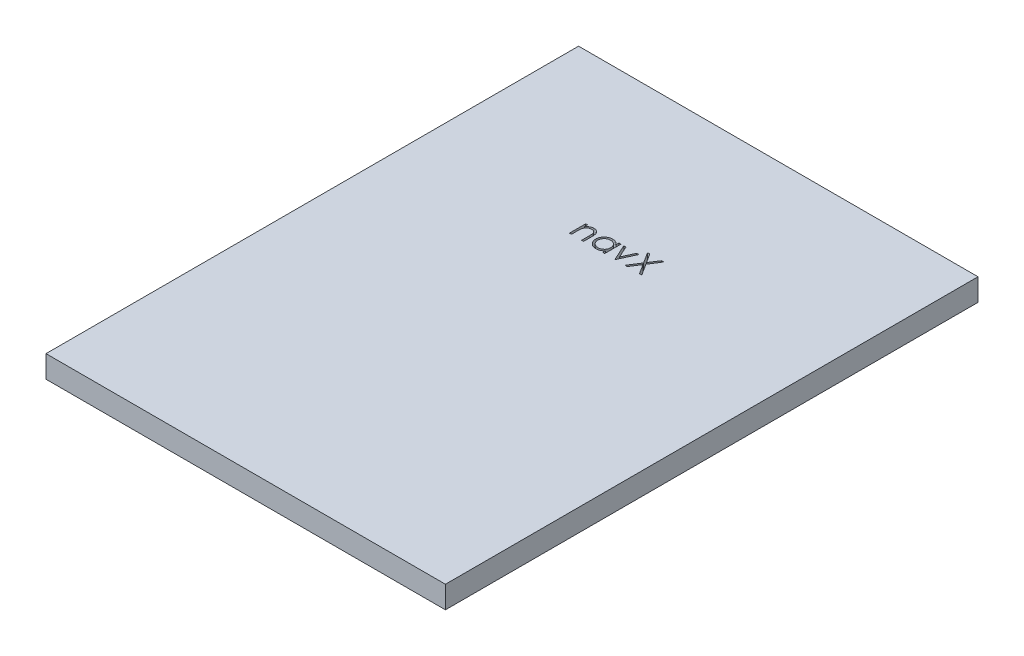
from build123d import *

# Parameters (mm, degrees)
SKETCH1_W           = 57.15
SKETCH1_H           = 76.2
BOSS_EXTRUDE1_DEPTH = 3.175
CUT_EXTRUDE1_DEPTH  = 1.27


with BuildPart() as part:
    # Sketch1 → Boss-Extrude1 (new body)
    with BuildSketch(Plane(origin=(0, 0, 0), x_dir=(1, 0, 0), z_dir=(0, 1, 0))):
        Rectangle(SKETCH1_W, SKETCH1_H)
    extrude(amount=BOSS_EXTRUDE1_DEPTH)

    # Sketch2 → Cut-Extrude1 (cut)
    # profile 1 of 4: a face of its own
    with BuildSketch(Plane(origin=(0, 3.175, 0), x_dir=(-1, 0, 0), z_dir=(0, 1, 0))):
        with BuildLine():
            Line((6.055318585, -16.590002596), (5.770382688, -16.590002596))
            Line((5.770382688, -16.590002596), (5.770382688, -16.171502996))
            add(Edge.make_bspline(
                [(5.770382688, -16.171502996), (5.740011779, -16.209517079), (5.68116854, -16.283168869), (5.58216602, -16.379210072), (5.478935847, -16.459804005), (5.3698014, -16.523260139), (5.255885696, -16.571252171), (5.137511969, -16.605860082), (5.01403952, -16.626623661), (4.930069938, -16.629335713), (4.88759022, -16.630707724)],
                knots=[0, 0, 0, 0, 1.127869841, 2.185233117, 3.191641716, 4.159226741, 5.10472073, 6.052603964, 7.014823782, 8, 8, 8, 8], degree=3))
            add(Edge.make_bspline(
                [(4.88759022, -16.630707724), (4.844634079, -16.629214017), (4.760516404, -16.626289008), (4.638482352, -16.600515848), (4.523708355, -16.559729658), (4.417729129, -16.502406678), (4.322175382, -16.431236503), (4.239313996, -16.347753357), (4.169631782, -16.252962996), (4.123122139, -16.164236993), (4.093040195, -16.085425579), (4.073271524, -16.0180161), (4.057278247, -15.942883297), (4.04294765, -15.86021293), (4.033387568, -15.769672957), (4.025809426, -15.671479471), (4.020388991, -15.565649476), (4.020173366, -15.492455289), (4.020062175, -15.454711129)],
                knots=[0, 0, 0, 0, 1.235764162, 2.419900973, 3.574701258, 4.732869372, 5.875730734, 6.993815468, 8.107424371, 9.251605764, 9.866123335, 10.534503958, 11.272175692, 12.077112099, 12.949509943, 13.89253218, 14.913238789, 16, 16, 16, 16], degree=3))
            Line((4.020062175, -15.454711129), (4.020062175, -14.269810288))
            Line((4.020062175, -14.269810288), (4.304998072, -14.269810288))
            Line((4.304998072, -14.269810288), (4.304998072, -15.361216538))
            add(Edge.make_bspline(
                [(4.304998072, -15.361216538), (4.305172614, -15.392805516), (4.305506484, -15.453229854), (4.306573304, -15.539742593), (4.30908455, -15.617988608), (4.312758395, -15.688192769), (4.31790085, -15.750098127), (4.323405942, -15.804018032), (4.330082808, -15.849474875), (4.33603676, -15.876838879), (4.338707007, -15.889111169)],
                knots=[0, 0, 0, 0, 1.430803381, 2.736883362, 3.918614142, 4.976458302, 5.92063272, 6.731858525, 7.431260095, 8, 8, 8, 8], degree=3))
            add(Edge.make_bspline(
                [(4.338707007, -15.889111169), (4.348298036, -15.925160767), (4.366708706, -15.994360559), (4.413127221, -16.088064198), (4.470383963, -16.168488135), (4.541323753, -16.233978346), (4.624041324, -16.28496079), (4.718674187, -16.320307963), (4.824242938, -16.342422975), (4.898497037, -16.344624403), (4.937199595, -16.345771826)],
                knots=[0, 0, 0, 0, 1.084232, 2.08126119, 3.027460722, 3.945137793, 4.874029258, 5.839697328, 6.874011781, 8, 8, 8, 8], degree=3))
            add(Edge.make_bspline(
                [(4.937199595, -16.345771826), (4.960123112, -16.345346396), (5.005488159, -16.344504481), (5.072721891, -16.335837862), (5.13814421, -16.32215003), (5.201579846, -16.301932164), (5.263156997, -16.277350064), (5.323130484, -16.247186672), (5.380662305, -16.210701491), (5.436561438, -16.1696921), (5.488517318, -16.124022995), (5.537550393, -16.076530302), (5.580632017, -16.025225386), (5.619738091, -15.971922216), (5.653454407, -15.915550043), (5.682896587, -15.856711455), (5.707874702, -15.79531338), (5.720286952, -15.752700383), (5.726497471, -15.731378798)],
                knots=[0, 0, 0, 0, 1.023939463, 2.026349741, 3.024227553, 4.007104963, 4.997624259, 5.984875705, 7.002218968, 8.038748769, 9.079772093, 10.091408226, 11.086177727, 12.069739863, 13.043026652, 14.017557731, 15.008077027, 16, 16, 16, 16], degree=3))
            add(Edge.make_bspline(
                [(5.726497471, -15.731378798), (5.730071296, -15.715725863), (5.737851324, -15.681650245), (5.746254351, -15.62572995), (5.753881223, -15.561041615), (5.76026475, -15.487660728), (5.764170378, -15.40533037), (5.768428866, -15.314402145), (5.769979229, -15.214513481), (5.770244435, -15.144970374), (5.770382688, -15.10871754)],
                knots=[0, 0, 0, 0, 0.615963638, 1.340920617, 2.168419149, 3.115676021, 4.16674242, 5.331190069, 6.6087489, 8, 8, 8, 8], degree=3))
            Line((5.770382688, -15.10871754), (5.770382688, -14.269810288))
            Line((5.770382688, -14.269810288), (6.055318585, -14.269810288))
            Line((6.055318585, -14.269810288), (6.055318585, -16.590002596))
        make_face()
    # profile 2 of 4: a face of its own
    with BuildSketch(Plane(origin=(0, 3.175, 0), x_dir=(-1, 0, 0), z_dir=(0, 1, 0))):
        with BuildLine():
            Line((1.007882688, -16.590002596), (1.007882688, -14.269810288))
            Line((1.007882688, -14.269810288), (1.292818585, -14.269810288))
            Line((1.292818585, -14.269810288), (1.292818585, -14.671137411))
            add(Edge.make_bspline(
                [(1.292818585, -14.671137411), (1.324992017, -14.63486586), (1.387872244, -14.563976207), (1.491888052, -14.470793448), (1.603055633, -14.394714311), (1.719481041, -14.332960727), (1.842065446, -14.286409707), (1.970088917, -14.25361509), (2.103451285, -14.232281726), (2.194397192, -14.230173515), (2.240484851, -14.22910516)],
                knots=[0, 0, 0, 0, 1.074235403, 2.099501444, 3.086304576, 4.053325556, 5.01427503, 5.985443889, 6.979105517, 8, 8, 8, 8], degree=3))
            add(Edge.make_bspline(
                [(2.240484851, -14.22910516), (2.281458749, -14.23021747), (2.362261091, -14.232410995), (2.481121581, -14.249433739), (2.595511176, -14.276756716), (2.705502779, -14.314802885), (2.810351107, -14.365009415), (2.910646951, -14.425766251), (3.006624386, -14.497409293), (3.09645812, -14.579631484), (3.179287048, -14.668842021), (3.251753995, -14.76427022), (3.313172092, -14.864605375), (3.363646768, -14.969819287), (3.402706719, -15.079835045), (3.429881876, -15.194577175), (3.446886276, -15.313854753), (3.44907869, -15.395080238), (3.45019038, -15.436266618)],
                knots=[0, 0, 0, 0, 1.034036272, 2.039165313, 3.024406509, 3.999331371, 4.971254918, 5.953351348, 6.95522652, 7.989525907, 9.023492927, 10.024309745, 11.009187477, 11.988246066, 12.964946762, 13.950187958, 14.960617622, 16, 16, 16, 16], degree=3))
            add(Edge.make_bspline(
                [(3.45019038, -15.436266618), (3.449054033, -15.476601721), (3.446807536, -15.556342044), (3.430063828, -15.673613807), (3.401929041, -15.78657883), (3.362370202, -15.894818649), (3.311868686, -15.998769181), (3.249394337, -16.097617116), (3.176953503, -16.192874548), (3.093239343, -16.281486741), (3.002599318, -16.363041853), (2.9060849, -16.434859002), (2.804899525, -16.495460062), (2.698840305, -16.544722833), (2.58865823, -16.583870029), (2.473516308, -16.611159395), (2.353938157, -16.627201173), (2.272758349, -16.629527643), (2.231580605, -16.630707724)],
                knots=[0, 0, 0, 0, 1.02050356, 2.017480486, 2.990790918, 3.96161403, 4.928589988, 5.909588639, 6.91611943, 7.952353252, 8.989586576, 9.99823133, 10.991940466, 11.968822692, 12.952985106, 13.945868367, 14.958059758, 16, 16, 16, 16], degree=3))
            add(Edge.make_bspline(
                [(2.231580605, -16.630707724), (2.18422693, -16.629408375), (2.09136861, -16.626860413), (1.955354868, -16.605475308), (1.826625065, -16.569681193), (1.7040642, -16.520825915), (1.589394651, -16.455035241), (1.481514052, -16.373630088), (1.381702446, -16.274636931), (1.322959063, -16.199329814), (1.292818585, -16.160690697)],
                knots=[0, 0, 0, 0, 1.038908319, 2.037250181, 3.012632028, 3.966567879, 4.9252131, 5.905168122, 6.925168603, 8, 8, 8, 8], degree=3))
            Line((1.292818585, -16.160690697), (1.292818585, -16.590002596))
            Line((1.292818585, -16.590002596), (1.007882688, -16.590002596))
        make_face()
        with BuildLine():
            add(Edge.make_bspline(
                [(2.227764499, -16.345771826), (2.269414491, -16.344288631), (2.351624951, -16.34136104), (2.472327468, -16.318543194), (2.587771574, -16.28047983), (2.697769535, -16.228723763), (2.799284509, -16.162425838), (2.891515583, -16.084255444), (2.971962531, -15.993254844), (3.039982689, -15.891514792), (3.096452027, -15.783098406), (3.135420255, -15.668939236), (3.161303129, -15.552122774), (3.163933935, -15.472868592), (3.165254483, -15.43308653)],
                knots=[0, 0, 0, 0, 1.031179624, 2.035384561, 3.030098214, 4.035455833, 5.037557836, 6.024646278, 7.02156144, 8.035264006, 9.049836703, 10.039645228, 11.015989397, 12, 12, 12, 12], degree=3))
            add(Edge.make_bspline(
                [(3.165254483, -15.43308653), (3.163540249, -15.393551932), (3.160118502, -15.3146377), (3.136215415, -15.197642221), (3.094258569, -15.08422785), (3.039024474, -14.974413926), (2.969933592, -14.871915003), (2.889645422, -14.779234125), (2.79694635, -14.699858737), (2.694537475, -14.633373426), (2.585275386, -14.579891334), (2.47033249, -14.542170246), (2.351712204, -14.518353481), (2.270912571, -14.515483367), (2.230308569, -14.514041057)],
                knots=[0, 0, 0, 0, 0.979235476, 1.954632679, 2.943119654, 3.967171814, 4.992637064, 5.997548408, 6.995574264, 8.005058949, 9.015076297, 9.999929117, 10.994910263, 12, 12, 12, 12], degree=3))
            add(Edge.make_bspline(
                [(2.230308569, -14.514041057), (2.189082755, -14.51554163), (2.107297234, -14.51851853), (1.986177363, -14.541493739), (1.868854415, -14.580029732), (1.756283853, -14.632504372), (1.651593001, -14.697560163), (1.558068615, -14.774059954), (1.477272541, -14.861666513), (1.41075029, -14.959856368), (1.357599909, -15.066314478), (1.319965408, -15.180022076), (1.297107538, -15.300303471), (1.294268004, -15.382739468), (1.292818585, -15.424818301)],
                knots=[0, 0, 0, 0, 1.017730373, 2.019016736, 3.032373701, 4.060729657, 5.079187105, 6.068726676, 7.03591854, 8.011858086, 8.988317194, 9.965225429, 10.961364673, 12, 12, 12, 12], degree=3))
            add(Edge.make_bspline(
                [(1.292818585, -15.424818301), (1.293689144, -15.456874749), (1.29540268, -15.519971983), (1.308493072, -15.612616408), (1.329317189, -15.701274213), (1.358657167, -15.786042436), (1.397212571, -15.8664383), (1.443664912, -15.943091998), (1.498966997, -16.015289511), (1.561435842, -16.082939407), (1.630584648, -16.14433424), (1.704115441, -16.198447131), (1.781843219, -16.244241527), (1.863713421, -16.280889022), (1.949095477, -16.310744817), (2.038807758, -16.330464053), (2.131946128, -16.344047564), (2.195488753, -16.345191021), (2.227764499, -16.345771826)],
                knots=[0, 0, 0, 0, 1.050062701, 2.066855696, 3.059271411, 4.030305351, 4.999747758, 5.975466543, 6.961907836, 7.974539719, 8.98812422, 9.98710676, 10.961662635, 11.93785114, 12.922015094, 13.919620009, 14.94329489, 16, 16, 16, 16], degree=3))
        make_face(mode=Mode.SUBTRACT)
    # profile 3 of 4: a face of its own
    with BuildSketch(Plane(origin=(0, 3.175, 0), x_dir=(-1, 0, 0), z_dir=(0, 1, 0))):
        Polygon((0.600831406, -16.590002596), (0.292362856, -16.590002596), (-0.477854492, -14.900739775), (-1.248071839, -16.590002596), (-1.556540389, -16.590002596), (-0.498207056, -14.269810288), (-0.457501928, -14.269810288), align=None)
    # profile 4 of 4: a face of its own
    with BuildSketch(Plane(origin=(0, 3.175, 0), x_dir=(-1, 0, 0), z_dir=(0, 1, 0))):
        Polygon((-1.943239107, -17.444810288), (-2.272060221, -17.444810288), (-3.103335261, -16.146062291), (-3.934610301, -17.444810288), (-4.263431415, -17.444810288), (-3.268063827, -15.889111169), (-4.304136543, -14.269810288), (-3.975315429, -14.269810288), (-3.103335261, -15.632160048), (-2.231355093, -14.269810288), (-1.902533979, -14.269810288), (-2.939242713, -15.889111169), align=None)
    extrude(amount=-CUT_EXTRUDE1_DEPTH, mode=Mode.SUBTRACT)


solid = part.part
